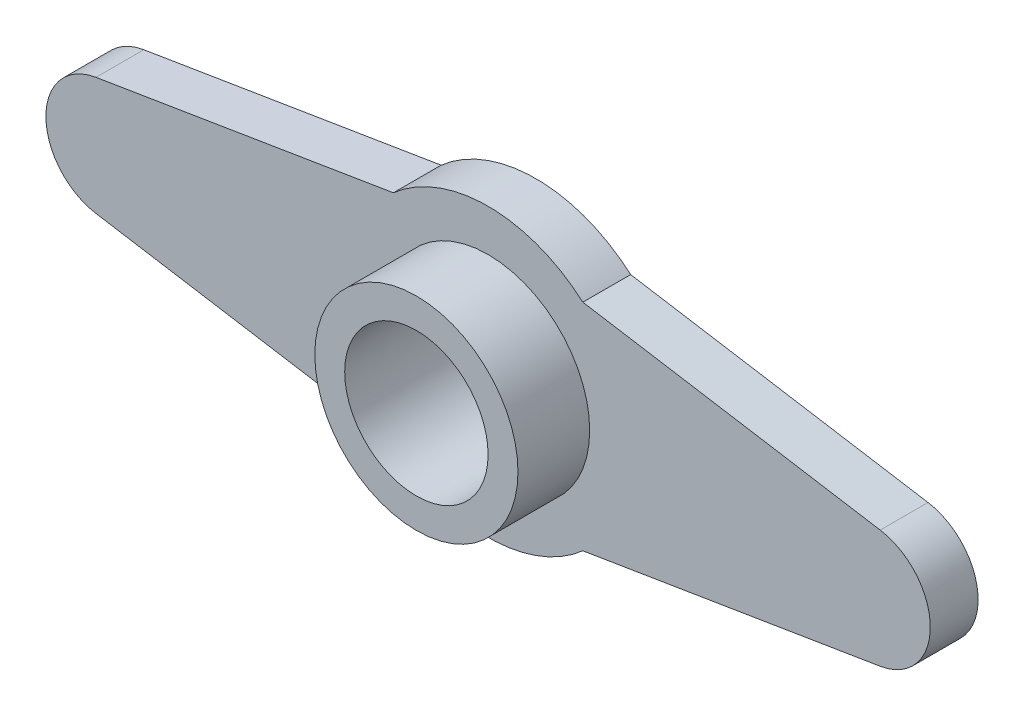
from build123d import *

# Parameters (mm, degrees)
BOSS_EXTRUDE1_DEPTH = 2
SKETCH2_R           = 4.25
BOSS_EXTRUDE2_DEPTH = 3
CUT_EXTRUDE1_REACH  = 22.081
SKETCH3_R           = 3


with BuildPart() as part:
    # Sketch1 → Boss-Extrude1 (new body)
    with BuildSketch(Plane.XY):
        with BuildLine():
            Line((-3.963767369, 4.504281102), (-16.404004536, 2.467140112))
            ThreePointArc((-16.404004536, 2.467140112), (-18.5, -1e-09), (-16.404004536, -2.467140113))
            Line((-16.404004536, -2.467140113), (-3.963767369, -4.504281102))
            ThreePointArc((-3.963767369, -4.504281102), (0, -6), (3.963767369, -4.504281102))
            Line((3.963767369, -4.504281102), (16.404004536, -2.467140112))
            ThreePointArc((16.404004536, -2.467140112), (18.5, 0), (16.404004536, 2.467140113))
            Line((16.404004536, 2.467140113), (3.963767369, 4.504281102))
            ThreePointArc((3.963767369, 4.504281102), (0, 6), (-3.963767369, 4.504281102))
        make_face()
    extrude(amount=BOSS_EXTRUDE1_DEPTH)

    # Sketch2 → Boss-Extrude2 (add)
    with BuildSketch(Plane.XY.offset(2)):
        Circle(SKETCH2_R)
    extrude(amount=BOSS_EXTRUDE2_DEPTH)

    # Sketch3 → Cut-Extrude1 (cut, up to next)
    with BuildSketch(Plane(origin=(0, 0, 0), x_dir=(-1, 0, 0), z_dir=(0, 0, -1)), mode=Mode.PRIVATE) as cut_extrude1_sk1:
        Circle(SKETCH3_R)
    cut_extrude1_tool1 = extrude(cut_extrude1_sk1.sketch, amount=-CUT_EXTRUDE1_REACH, mode=Mode.PRIVATE) & part.part
    add(cut_extrude1_tool1.solids().sort_by_distance((0, 0, 0))[0], mode=Mode.SUBTRACT)


solid = part.part
